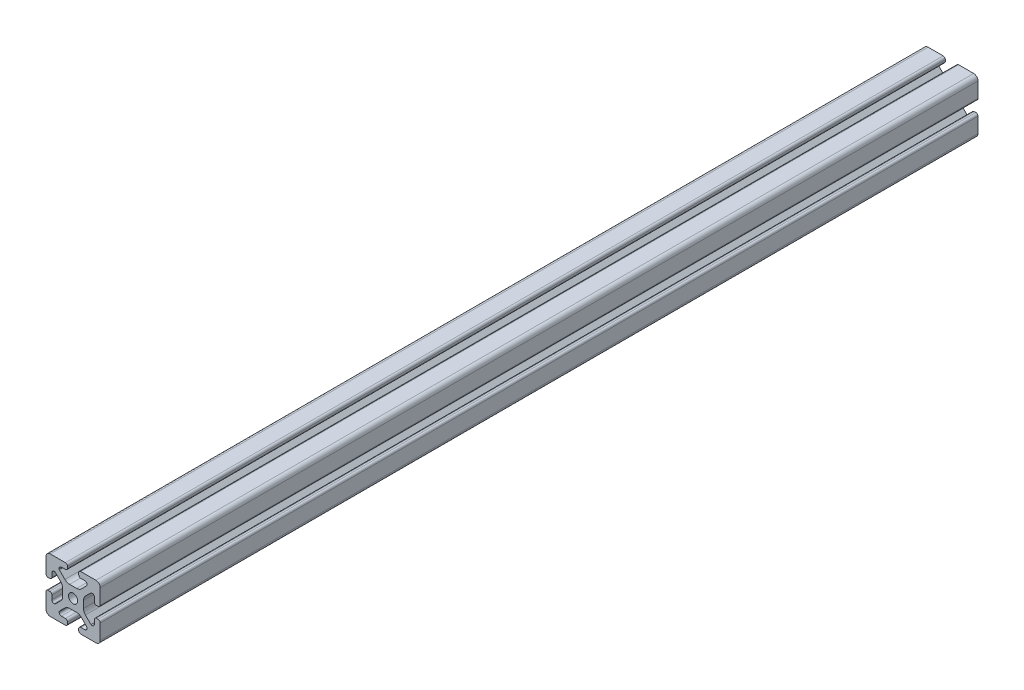
from build123d import *

# Parameters (mm, degrees)
SKETCH1_R           = 3.4
BOSS_EXTRUDE1_DEPTH = 4000
SKETCH2_W           = 240.449275058
SKETCH2_H           = 182.715753948
CUT_EXTRUDE1_DEPTH  = 3353.41931894


with BuildPart() as part:
    # Sketch1 → Boss-Extrude1 (new body)
    with BuildSketch(Plane(origin=(0, 0, -4000), x_dir=(-1, 0, 0), z_dir=(0, 0, -1))):
        with BuildLine():
            Line((16.83, 20), (5.69044933, 20))
            ThreePointArc((5.69044933, 20), (4.580291684, 19.540157646), (4.12044933, 18.43))
            Line((4.12044933, 18.43), (4.12044933, 17.25))
            ThreePointArc((4.12044933, 17.25), (4.580291684, 16.139842354), (5.69044933, 15.68))
            Line((5.69044933, 15.68), (8.7153995, 15.68))
            ThreePointArc((8.7153995, 15.68), (9.825557146, 15.220157646), (10.2853995, 14.11))
            Line((10.2853995, 14.11), (10.2853995, 13.654903102))
            ThreePointArc((10.2853995, 13.654903102), (10.227547945, 13.364063694), (10.062800654, 13.117501948))
            Line((10.062800654, 13.117501948), (6.055092794, 9.109794088))
            ThreePointArc((6.055092794, 9.109794088), (4.47691877, 8.055291919), (2.615335582, 7.685))
            Line((2.615335582, 7.685), (-2.615335582, 7.685))
            ThreePointArc((-2.615335582, 7.685), (-4.47691877, 8.055291919), (-6.055092794, 9.109794088))
            Line((-6.055092794, 9.109794088), (-10.062800654, 13.117501948))
            ThreePointArc((-10.062800654, 13.117501948), (-10.227547945, 13.364063694), (-10.2853995, 13.654903102))
            Line((-10.2853995, 13.654903102), (-10.2853995, 14.11))
            ThreePointArc((-10.2853995, 14.11), (-9.825557146, 15.220157646), (-8.7153995, 15.68))
            Line((-8.7153995, 15.68), (-5.69044933, 15.68))
            ThreePointArc((-5.69044933, 15.68), (-4.580291684, 16.139842354), (-4.12044933, 17.25))
            Line((-4.12044933, 17.25), (-4.12044933, 18.43))
            ThreePointArc((-4.12044933, 18.43), (-4.580291684, 19.540157646), (-5.69044933, 20))
            Line((-5.69044933, 20), (-16.83, 20))
            ThreePointArc((-16.83, 20), (-19.071528496, 19.071528496), (-20, 16.83))
            Line((-20, 16.83), (-20, 5.69044933))
            ThreePointArc((-20, 5.69044933), (-19.540157646, 4.580291684), (-18.43, 4.12044933))
            Line((-18.43, 4.12044933), (-17.25, 4.12044933))
            ThreePointArc((-17.25, 4.12044933), (-16.139842354, 4.580291684), (-15.68, 5.69044933))
            Line((-15.68, 5.69044933), (-15.68, 8.7153995))
            ThreePointArc((-15.68, 8.7153995), (-15.220157646, 9.825557146), (-14.11, 10.2853995))
            Line((-14.11, 10.2853995), (-13.654903102, 10.2853995))
            ThreePointArc((-13.654903102, 10.2853995), (-13.364063694, 10.227547945), (-13.117501948, 10.062800654))
            Line((-13.117501948, 10.062800654), (-9.109794088, 6.055092794))
            ThreePointArc((-9.109794088, 6.055092794), (-8.055291919, 4.47691877), (-7.685, 2.615335582))
            Line((-7.685, 2.615335582), (-7.685, -2.615335582))
            ThreePointArc((-7.685, -2.615335582), (-8.055291919, -4.47691877), (-9.109794088, -6.055092794))
            Line((-9.109794088, -6.055092794), (-13.117501948, -10.062800654))
            ThreePointArc((-13.117501948, -10.062800654), (-13.364063694, -10.227547945), (-13.654903102, -10.2853995))
            Line((-13.654903102, -10.2853995), (-14.11, -10.2853995))
            ThreePointArc((-14.11, -10.2853995), (-15.220157646, -9.825557146), (-15.68, -8.7153995))
            Line((-15.68, -8.7153995), (-15.68, -5.69044933))
            ThreePointArc((-15.68, -5.69044933), (-16.139842354, -4.580291684), (-17.25, -4.12044933))
            Line((-17.25, -4.12044933), (-18.43, -4.12044933))
            ThreePointArc((-18.43, -4.12044933), (-19.540157646, -4.580291684), (-20, -5.69044933))
            Line((-20, -5.69044933), (-20, -16.83))
            ThreePointArc((-20, -16.83), (-19.071528496, -19.071528496), (-16.83, -20))
            Line((-16.83, -20), (-5.69044933, -20))
            ThreePointArc((-5.69044933, -20), (-4.580291684, -19.540157646), (-4.12044933, -18.43))
            Line((-4.12044933, -18.43), (-4.12044933, -17.25))
            ThreePointArc((-4.12044933, -17.25), (-4.580291684, -16.139842354), (-5.69044933, -15.68))
            Line((-5.69044933, -15.68), (-8.7153995, -15.68))
            ThreePointArc((-8.7153995, -15.68), (-9.825557146, -15.220157646), (-10.2853995, -14.11))
            Line((-10.2853995, -14.11), (-10.2853995, -13.654903102))
            ThreePointArc((-10.2853995, -13.654903102), (-10.227547945, -13.364063694), (-10.062800654, -13.117501948))
            Line((-10.062800654, -13.117501948), (-6.055092794, -9.109794088))
            ThreePointArc((-6.055092794, -9.109794088), (-4.47691877, -8.055291919), (-2.615335582, -7.685))
            Line((-2.615335582, -7.685), (2.615335582, -7.685))
            ThreePointArc((2.615335582, -7.685), (4.47691877, -8.055291919), (6.055092794, -9.109794088))
            Line((6.055092794, -9.109794088), (10.062800654, -13.117501948))
            ThreePointArc((10.062800654, -13.117501948), (10.227547945, -13.364063694), (10.2853995, -13.654903102))
            Line((10.2853995, -13.654903102), (10.2853995, -14.11))
            ThreePointArc((10.2853995, -14.11), (9.825557146, -15.220157646), (8.7153995, -15.68))
            Line((8.7153995, -15.68), (5.69044933, -15.68))
            ThreePointArc((5.69044933, -15.68), (4.580291684, -16.139842354), (4.12044933, -17.25))
            Line((4.12044933, -17.25), (4.12044933, -18.43))
            ThreePointArc((4.12044933, -18.43), (4.580291684, -19.540157646), (5.69044933, -20))
            Line((5.69044933, -20), (16.83, -20))
            ThreePointArc((16.83, -20), (19.071528496, -19.071528496), (20, -16.83))
            Line((20, -16.83), (20, -5.69044933))
            ThreePointArc((20, -5.69044933), (19.540157646, -4.580291684), (18.43, -4.12044933))
            Line((18.43, -4.12044933), (17.25, -4.12044933))
            ThreePointArc((17.25, -4.12044933), (16.139842354, -4.580291684), (15.68, -5.69044933))
            Line((15.68, -5.69044933), (15.68, -8.7153995))
            ThreePointArc((15.68, -8.7153995), (15.220157646, -9.825557146), (14.11, -10.2853995))
            Line((14.11, -10.2853995), (13.654903102, -10.2853995))
            ThreePointArc((13.654903102, -10.2853995), (13.364063694, -10.227547945), (13.117501948, -10.062800654))
            Line((13.117501948, -10.062800654), (9.109794088, -6.055092794))
            ThreePointArc((9.109794088, -6.055092794), (8.055291919, -4.47691877), (7.685, -2.615335582))
            Line((7.685, -2.615335582), (7.685, 2.615335582))
            ThreePointArc((7.685, 2.615335582), (8.055291919, 4.47691877), (9.109794088, 6.055092794))
            Line((9.109794088, 6.055092794), (13.117501948, 10.062800654))
            ThreePointArc((13.117501948, 10.062800654), (13.364063694, 10.227547945), (13.654903102, 10.2853995))
            Line((13.654903102, 10.2853995), (14.11, 10.2853995))
            ThreePointArc((14.11, 10.2853995), (15.220157646, 9.825557146), (15.68, 8.7153995))
            Line((15.68, 8.7153995), (15.68, 5.69044933))
            ThreePointArc((15.68, 5.69044933), (16.139842354, 4.580291684), (17.25, 4.12044933))
            Line((17.25, 4.12044933), (18.43, 4.12044933))
            ThreePointArc((18.43, 4.12044933), (19.540157646, 4.580291684), (20, 5.69044933))
            Line((20, 5.69044933), (20, 16.83))
            ThreePointArc((20, 16.83), (19.071528496, 19.071528496), (16.83, 20))
        make_face()
        with Locations(Location((0, 0, 0), (0, 0, 180))):
            Circle(SKETCH1_R, mode=Mode.SUBTRACT)
    extrude(amount=-BOSS_EXTRUDE1_DEPTH)

    # Sketch2 → Cut-Extrude1 (cut, through all)
    with BuildSketch(Plane.XY.offset(-647.7)):
        Rectangle(SKETCH2_W, SKETCH2_H)
    extrude(amount=-CUT_EXTRUDE1_DEPTH, mode=Mode.SUBTRACT)


solid = part.part
